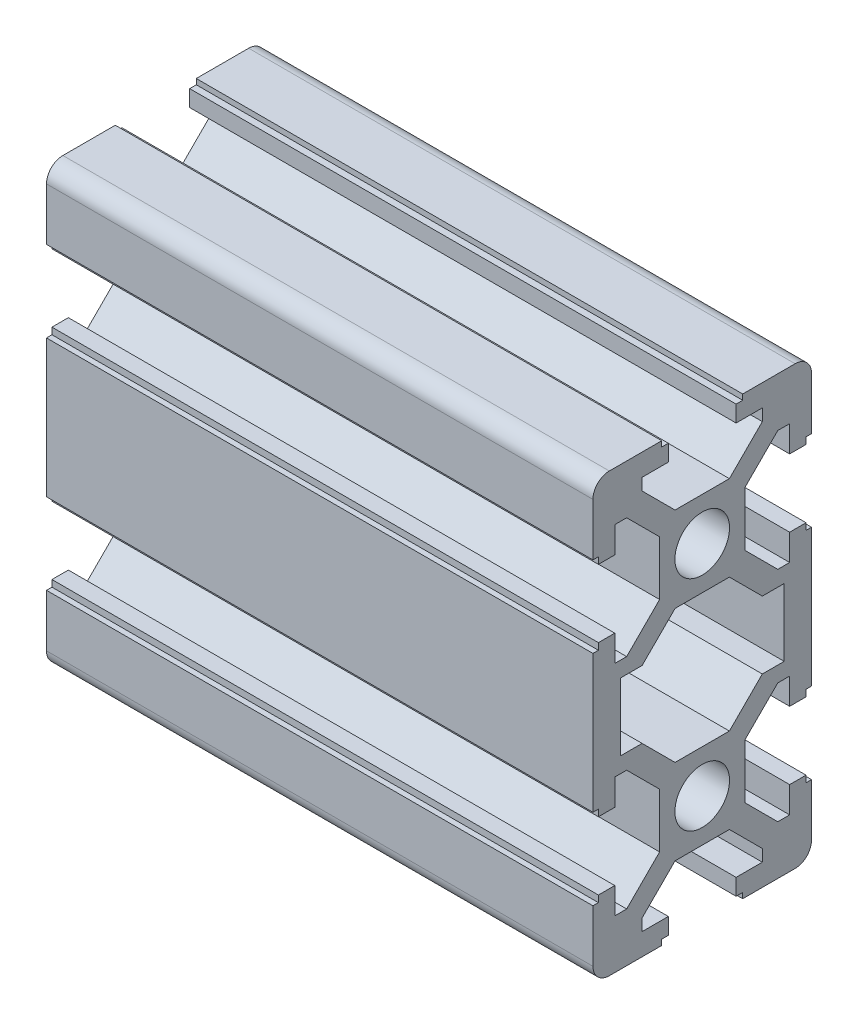
from build123d import *

# Parameters (mm, degrees)
SKETCH_1_W                = 1048
SKETCH_1_H                = 40
EXTRUDE_1_DEPTH           = 20
CUT_EXTRUDE_1_DEPTH       = 1049.239330799
CUT_EXTRUDE_2_REACH       = 1050.811
CUT_EXTRUDE_3_REACH       = 1050.239
CUT_EXTRUDE_3_END_RADIUS  = 5
SKETCH_4_W                = 0.605
SKETCH_4_H                = 0.5
CUT_EXTRUDE_4_DEPTH       = 1049.239330799
CUT_EXTRUDE_5_DEPTH       = 1049.737119623
CUT_EXTRUDE_6_REACH       = 1050.239
CUT_EXTRUDE_6_END_RADIUS  = 5
SKETCH_7_W                = 0.605
SKETCH_7_H                = 0.5
CUT_EXTRUDE_7_REACH       = 1050.811
CUT_EXTRUDE_8_REACH       = 1050.239
CUT_EXTRUDE_8_END_RADIUS  = 5
SKETCH_9_W                = 0.605
SKETCH_9_H                = 0.5
CUT_EXTRUDE_9_REACH       = 1050.239
CUT_EXTRUDE_9_END_RADIUS  = 5
SKETCH_10_W               = 0.605
SKETCH_10_H               = 0.5
CUT_EXTRUDE_10_DEPTH      = 1049.737119623
CUT_EXTRUDE_11_REACH      = 1050.239
CUT_EXTRUDE_11_END_RADIUS = 5
SKETCH_12_W               = 0.605
SKETCH_12_H               = 0.5
CUT_EXTRUDE_12_DEPTH      = 1049.239330799
CUT_EXTRUDE_13_DEPTH      = 1049.239330799
CUT_EXTRUDE_14_REACH      = 1050.239
CUT_EXTRUDE_14_END_RADIUS = 5
SKETCH_15_W               = 0.605
SKETCH_15_H               = 0.5
CUT_EXTRUDE_15_REACH      = 1050.239
CUT_EXTRUDE_15_END_RADIUS = 5
SKETCH_16_W               = 0.605
SKETCH_16_H               = 0.5
CUT_EXTRUDE_16_DEPTH      = 1049.239330799
CUT_EXTRUDE_17_DEPTH      = 1049.239330799
CUT_EXTRUDE_18_REACH      = 1050.239
CUT_EXTRUDE_18_END_RADIUS = 5
SKETCH_19_W               = 0.605
SKETCH_19_H               = 0.5
CUT_EXTRUDE_19_DEPTH      = 1049.239330799
DRAFT_1_ANGLE             = 45
DRAFT_2_ANGLE             = 45
SKETCH_21_W               = 5
SKETCH_21_H               = 5.49122085
SKETCH_22_W               = 5
SKETCH_22_H               = 5.49864809
HOLE_WIZARD_5_0_5_1_D     = 4.999999999
HOLE_WIZARD_5_0_5_2_D     = 4.999999999
FILLET_1_R                = 1.5
SKETCH_27_W               = 25
SKETCH_27_H               = 45
CUT_EXTRUDE_21_DEPTH      = 496.5
CUT_EXTRUDE_START         = -1048
SKETCH_28_W               = 25
SKETCH_28_H               = 45
CUT_EXTRUDE_22_DEPTH      = 501.5


with BuildPart() as part:
    # 草图1 → 凸台-拉伸1 (new body)
    with BuildSketch(Plane.XY.offset(9.92299271)):
        with Locations((-524, -0.00371362)):
            Rectangle(SKETCH_1_W, SKETCH_1_H)
    extrude(amount=-EXTRUDE_1_DEPTH)

    # 草图2 → 切除-拉伸1 (cut, through all)
    with BuildSketch(Plane(origin=(0, 0, 0), x_dir=(0, 0, -1), z_dir=(1, 0, 0))):
        Polygon((-3.02299271, 19.99628638), (-3.02299271, 17.99628638), (-5.42299271, 17.99628638), (-5.42299271, 16.91049994), (-2.40877915, 13.89628638), (2.56279373, 13.89628638), (5.57700729, 16.91049994), (5.57700729, 17.99628638), (3.17700729, 17.99628638), (3.17700729, 19.99628638), align=None)
    extrude(amount=-CUT_EXTRUDE_1_DEPTH, mode=Mode.SUBTRACT)

    # 草图3 → 切除-拉伸2 (cut, up to next)
    with BuildSketch(Plane(origin=(0, 19.99628638, 0), x_dir=(-1, 0, 0), z_dir=(0, 1, 0)), mode=Mode.PRIVATE) as cut_extrude_2_sk1:
        with BuildLine():
            Line((9.017348236, 3.02299271), (16.982651764, 3.02299271))
            ThreePointArc((16.982651764, 3.02299271), (13, 5), (9.017348236, 3.02299271))
        make_face()
    cut_extrude_2_tool1 = extrude(cut_extrude_2_sk1.sketch, amount=-CUT_EXTRUDE_2_REACH, mode=Mode.PRIVATE) & part.part
    add(cut_extrude_2_tool1.solids().sort_by_distance((-13, 19.996286, 3.828944))[0], mode=Mode.SUBTRACT)

    # 切除-拉伸3: up to this cylinder (the profile starts outside it)
    cut_extrude_3_end = Plane(origin=(-13, 19.746286, 0), z_dir=(0, 1, 0)) * Cylinder(CUT_EXTRUDE_3_END_RADIUS, 2111.478, mode=Mode.PRIVATE)
    # 草图4 → 切除-拉伸3 (cut, up to the surface)
    with BuildSketch(Plane.ZY.offset(1048), mode=Mode.PRIVATE) as cut_extrude_3_sk1:
        with Locations((3.32549271, 19.74628638)):
            Rectangle(SKETCH_4_W, SKETCH_4_H)
    cut_extrude_3_tool1 = extrude(cut_extrude_3_sk1.sketch, amount=-CUT_EXTRUDE_3_REACH, mode=Mode.PRIVATE) - cut_extrude_3_end
    add(cut_extrude_3_tool1.solids().sort_by_distance((-1048, 19.746286, 3.325493))[0], mode=Mode.SUBTRACT)

    # 草图5 → 切除-拉伸4 (cut, through all)
    with BuildSketch(Plane(origin=(0, 0, 0), x_dir=(0, 0, -1), z_dir=(1, 0, 0))):
        Polygon((-3.02299271, -20.00371362), (3.17700729, -20.00371362), (3.17700729, -18.00371362), (5.57700729, -18.00371362), (5.57700729, -16.91792718), (2.56279373, -13.90371362), (-2.40877915, -13.90371362), (-5.42299271, -16.91792718), (-5.42299271, -18.00371362), (-3.02299271, -18.00371362), align=None)
    extrude(amount=-CUT_EXTRUDE_4_DEPTH, mode=Mode.SUBTRACT)

    # 草图6 → 切除-拉伸5 (cut, through all)
    with BuildSketch(Plane(origin=(0, -18.00371362, 0), x_dir=(-1, 0, 0), z_dir=(0, 1, 0))):
        with BuildLine():
            Line((9.017348236, 3.02299271), (16.982651764, 3.02299271))
            ThreePointArc((16.982651764, 3.02299271), (13, 5), (9.017348236, 3.02299271))
        make_face()
    extrude(amount=-CUT_EXTRUDE_5_DEPTH, mode=Mode.SUBTRACT)

    # 切除-拉伸6: up to this cylinder (the profile starts outside it)
    cut_extrude_6_end = Plane(origin=(-13, -19.753714, 0), z_dir=(0, 1, 0)) * Cylinder(CUT_EXTRUDE_6_END_RADIUS, 2111.478, mode=Mode.PRIVATE)
    # 草图7 → 切除-拉伸6 (cut, up to the surface)
    with BuildSketch(Plane.ZY.offset(1048), mode=Mode.PRIVATE) as cut_extrude_6_sk1:
        with Locations((3.32549271, -19.75371362)):
            Rectangle(SKETCH_7_W, SKETCH_7_H)
    cut_extrude_6_tool1 = extrude(cut_extrude_6_sk1.sketch, amount=-CUT_EXTRUDE_6_REACH, mode=Mode.PRIVATE) - cut_extrude_6_end
    add(cut_extrude_6_tool1.solids().sort_by_distance((-1048, -19.753714, 3.325493))[0], mode=Mode.SUBTRACT)

    # 草图8 → 切除-拉伸7 (cut, up to next)
    with BuildSketch(Plane.XZ.offset(20.00371362), mode=Mode.PRIVATE) as cut_extrude_7_sk1:
        with BuildLine():
            Line((-9.139090175, -3.17700729), (-16.860909825, -3.17700729))
            ThreePointArc((-16.860909825, -3.17700729), (-13, -5), (-9.139090175, -3.17700729))
        make_face()
    cut_extrude_7_tool1 = extrude(cut_extrude_7_sk1.sketch, amount=-CUT_EXTRUDE_7_REACH, mode=Mode.PRIVATE) & part.part
    add(cut_extrude_7_tool1.solids().sort_by_distance((-13, -20.003714, -3.918953))[0], mode=Mode.SUBTRACT)

    # 切除-拉伸8: up to this cylinder (the profile starts outside it)
    cut_extrude_8_end = Plane(origin=(-13, -19.753714, 0), z_dir=(0, -1, 0)) * Cylinder(CUT_EXTRUDE_8_END_RADIUS, 2111.478, mode=Mode.PRIVATE)
    # 草图9 → 切除-拉伸8 (cut, up to the surface)
    with BuildSketch(Plane.ZY.offset(1048), mode=Mode.PRIVATE) as cut_extrude_8_sk1:
        with Locations((-3.47950729, -19.75371362)):
            Rectangle(SKETCH_9_W, SKETCH_9_H)
    cut_extrude_8_tool1 = extrude(cut_extrude_8_sk1.sketch, amount=-CUT_EXTRUDE_8_REACH, mode=Mode.PRIVATE) - cut_extrude_8_end
    add(cut_extrude_8_tool1.solids().sort_by_distance((-1048, -19.753714, -3.479507))[0], mode=Mode.SUBTRACT)

    # 切除-拉伸9: up to this cylinder (the profile starts outside it)
    cut_extrude_9_end = Plane(origin=(-13, 19.746286, 0), z_dir=(0, 1, 0)) * Cylinder(CUT_EXTRUDE_9_END_RADIUS, 2111.478, mode=Mode.PRIVATE)
    # 草图10 → 切除-拉伸9 (cut, up to the surface)
    with BuildSketch(Plane(origin=(0, 0, 0), x_dir=(0, 0, -1), z_dir=(1, 0, 0)), mode=Mode.PRIVATE) as cut_extrude_9_sk1:
        with Locations((-3.32549271, 19.74628638)):
            Rectangle(SKETCH_10_W, SKETCH_10_H)
    cut_extrude_9_tool1 = extrude(cut_extrude_9_sk1.sketch, amount=-CUT_EXTRUDE_9_REACH, mode=Mode.PRIVATE) - cut_extrude_9_end
    add(cut_extrude_9_tool1.solids().sort_by_distance((0, 19.746286, 3.325493))[0], mode=Mode.SUBTRACT)

    # 草图11 → 切除-拉伸10 (cut, through all)
    with BuildSketch(Plane.XZ.offset(-17.99628638)):
        with BuildLine():
            Line((-9.139090175, -3.17700729), (-16.860909825, -3.17700729))
            ThreePointArc((-16.860909825, -3.17700729), (-13, -5), (-9.139090175, -3.17700729))
        make_face()
    extrude(amount=-CUT_EXTRUDE_10_DEPTH, mode=Mode.SUBTRACT)

    # 切除-拉伸11: up to this cylinder (the profile starts outside it)
    cut_extrude_11_end = Plane(origin=(-13, 19.746286, 0), z_dir=(0, -1, 0)) * Cylinder(CUT_EXTRUDE_11_END_RADIUS, 2111.478, mode=Mode.PRIVATE)
    # 草图12 → 切除-拉伸11 (cut, up to the surface)
    with BuildSketch(Plane(origin=(0, 0, 0), x_dir=(0, 0, -1), z_dir=(1, 0, 0)), mode=Mode.PRIVATE) as cut_extrude_11_sk1:
        with Locations((3.47950729, 19.74628638)):
            Rectangle(SKETCH_12_W, SKETCH_12_H)
    cut_extrude_11_tool1 = extrude(cut_extrude_11_sk1.sketch, amount=-CUT_EXTRUDE_11_REACH, mode=Mode.PRIVATE) - cut_extrude_11_end
    add(cut_extrude_11_tool1.solids().sort_by_distance((0, 19.746286, -3.479507))[0], mode=Mode.SUBTRACT)

    # 草图13 → 切除-拉伸12 (cut, through all)
    with BuildSketch(Plane(origin=(0, 0, 0), x_dir=(0, 0, -1), z_dir=(1, 0, 0))):
        Polygon((10.07700729, 13.70128638), (9.57700729, 13.70128638), (9.57700729, 13.09628638), (8.07700729, 13.09628638), (8.07700729, 15.49628638), (6.99122085, 15.49628638), (3.97700729, 12.48207282), (3.97700729, 7.51049994), (6.99122085, 4.49628638), (8.07700729, 4.49628638), (8.07700729, 6.89628638), (9.57700729, 6.89628638), (9.57700729, 6.29128638), (10.07700729, 6.29128638), align=None)
    extrude(amount=-CUT_EXTRUDE_12_DEPTH, mode=Mode.SUBTRACT)

    # 草图14 → 切除-拉伸13 (cut, through all)
    with BuildSketch(Plane(origin=(0, 0, 0), x_dir=(0, 0, -1), z_dir=(1, 0, 0))):
        Polygon((10.07700729, -6.29871362), (9.57700729, -6.29871362), (9.57700729, -6.90371362), (8.07700729, -6.90371362), (8.07700729, -4.50371362), (6.99122085, -4.50371362), (3.97700729, -7.51792718), (3.97700729, -12.48950006), (6.99122085, -15.50371362), (8.07700729, -15.50371362), (8.07700729, -13.10371362), (9.57700729, -13.10371362), (9.57700729, -13.70871362), (10.07700729, -13.70871362), align=None)
    extrude(amount=-CUT_EXTRUDE_13_DEPTH, mode=Mode.SUBTRACT)

    # 切除-拉伸14: up to this cylinder (the profile starts outside it)
    cut_extrude_14_end = Plane(origin=(-13, -19.753714, 0), z_dir=(0, -1, 0)) * Cylinder(CUT_EXTRUDE_14_END_RADIUS, 2111.478, mode=Mode.PRIVATE)
    # 草图15 → 切除-拉伸14 (cut, up to the surface)
    with BuildSketch(Plane(origin=(0, 0, 0), x_dir=(0, 0, -1), z_dir=(1, 0, 0)), mode=Mode.PRIVATE) as cut_extrude_14_sk1:
        with Locations((3.47950729, -19.75371362)):
            Rectangle(SKETCH_15_W, SKETCH_15_H)
    cut_extrude_14_tool1 = extrude(cut_extrude_14_sk1.sketch, amount=-CUT_EXTRUDE_14_REACH, mode=Mode.PRIVATE) - cut_extrude_14_end
    add(cut_extrude_14_tool1.solids().sort_by_distance((0, -19.753714, -3.479507))[0], mode=Mode.SUBTRACT)

    # 切除-拉伸15: up to this cylinder (the profile starts outside it)
    cut_extrude_15_end = Plane(origin=(-13, -19.753714, 0), z_dir=(0, 1, 0)) * Cylinder(CUT_EXTRUDE_15_END_RADIUS, 2111.478, mode=Mode.PRIVATE)
    # 草图16 → 切除-拉伸15 (cut, up to the surface)
    with BuildSketch(Plane(origin=(0, 0, 0), x_dir=(0, 0, -1), z_dir=(1, 0, 0)), mode=Mode.PRIVATE) as cut_extrude_15_sk1:
        with Locations((-3.32549271, -19.75371362)):
            Rectangle(SKETCH_16_W, SKETCH_16_H)
    cut_extrude_15_tool1 = extrude(cut_extrude_15_sk1.sketch, amount=-CUT_EXTRUDE_15_REACH, mode=Mode.PRIVATE) - cut_extrude_15_end
    add(cut_extrude_15_tool1.solids().sort_by_distance((0, -19.753714, 3.325493))[0], mode=Mode.SUBTRACT)

    # 草图17 → 切除-拉伸16 (cut, through all)
    with BuildSketch(Plane(origin=(0, 0, 0), x_dir=(0, 0, -1), z_dir=(1, 0, 0))):
        Polygon((-9.92299271, -13.70871362), (-9.42299271, -13.70871362), (-9.42299271, -13.10371362), (-7.92299271, -13.10371362), (-7.92299271, -15.50371362), (-6.83720627, -15.50371362), (-3.82299271, -12.48950006), (-3.82299271, -7.51792718), (-6.83720627, -4.50371362), (-7.92299271, -4.50371362), (-7.92299271, -6.90371362), (-9.42299271, -6.90371362), (-9.42299271, -6.29871362), (-9.92299271, -6.29871362), align=None)
    extrude(amount=-CUT_EXTRUDE_16_DEPTH, mode=Mode.SUBTRACT)

    # 草图18 → 切除-拉伸17 (cut, through all)
    with BuildSketch(Plane(origin=(0, 0, 0), x_dir=(0, 0, -1), z_dir=(1, 0, 0))):
        Polygon((-9.92299271, 6.29128638), (-9.42299271, 6.29128638), (-9.42299271, 6.89628638), (-7.92299271, 6.89628638), (-7.92299271, 4.49628638), (-6.83720627, 4.49628638), (-3.82299271, 7.51049994), (-3.82299271, 12.48207282), (-6.83720627, 15.49628638), (-7.92299271, 15.49628638), (-7.92299271, 13.09628638), (-9.42299271, 13.09628638), (-9.42299271, 13.70128638), (-9.92299271, 13.70128638), align=None)
    extrude(amount=-CUT_EXTRUDE_17_DEPTH, mode=Mode.SUBTRACT)

    # 切除-拉伸18: up to this cylinder (the profile starts outside it)
    cut_extrude_18_end = Plane(origin=(-13, 19.746286, 0), z_dir=(0, -1, 0)) * Cylinder(CUT_EXTRUDE_18_END_RADIUS, 2111.478, mode=Mode.PRIVATE)
    # 草图19 → 切除-拉伸18 (cut, up to the surface)
    with BuildSketch(Plane.ZY.offset(1048), mode=Mode.PRIVATE) as cut_extrude_18_sk1:
        with Locations((-3.47950729, 19.74628638)):
            Rectangle(SKETCH_19_W, SKETCH_19_H)
    cut_extrude_18_tool1 = extrude(cut_extrude_18_sk1.sketch, amount=-CUT_EXTRUDE_18_REACH, mode=Mode.PRIVATE) - cut_extrude_18_end
    add(cut_extrude_18_tool1.solids().sort_by_distance((-1048, 19.746286, -3.479507))[0], mode=Mode.SUBTRACT)

    # 草图20 → 切除-拉伸19 (cut, through all)
    with BuildSketch(Plane.ZY.offset(1048)):
        Polygon((2.40877915, -3.08950006), (7.42299271, -3.08950006), (7.42299271, 3.08207282), (2.40877915, 3.08207282), (2.40877915, 6.09628638), (-2.56279373, 6.09628638), (-2.56279373, 3.08207282), (-7.57700729, 3.08207282), (-7.57700729, -3.08950006), (-2.56279373, -3.08950006), (-2.56279373, -6.10371362), (2.40877915, -6.10371362), align=None)
    extrude(amount=-CUT_EXTRUDE_19_DEPTH, mode=Mode.SUBTRACT)

    # 拔模1
    draft_1_faces = [part.faces().sort_by_distance(p)[0] for p in [
        (-524, -4.59660684, 2.40877915),
        (-524, -4.59660684, -2.56279373),
    ]]
    draft(draft_1_faces, Plane(origin=(0, -6.10371362, -2.56279373), x_dir=(0, 0, 1), z_dir=(0, 1, 0)), DRAFT_1_ANGLE)

    # 拔模2
    draft_2_faces = [part.faces().sort_by_distance(p)[0] for p in [
        (-524, 4.5891796, -2.56279373),
        (-524, 4.5891796, 2.40877915),
    ]]
    draft(draft_2_faces, Plane(origin=(0, 6.09628638, 2.40877915), x_dir=(0, 0, -1), z_dir=(0, -1, 0)), DRAFT_2_ANGLE)

    # 草图21 → 切除-旋转1 (revolve, cut)
    with BuildSketch(Plane(origin=(0, 0, 0), x_dir=(-1, 0, 0), z_dir=(0, 0, -1)), mode=Mode.PRIVATE) as cut_revolve_1_sk:
        with Locations((10.5, 13.741896805)):
            Rectangle(SKETCH_21_W, SKETCH_21_H)
    revolve(cut_revolve_1_sk.sketch.rotate(Axis((-13, 10.99628638, 0), (0, 1, 0)), 229.871289748), axis=Axis((-13, 10.99628638, 0), (0, 1, 0)), mode=Mode.SUBTRACT)

    # 草图22 → 切除-旋转2 (revolve, cut)
    with BuildSketch(Plane.XY, mode=Mode.PRIVATE) as cut_revolve_2_sk:
        with Locations((-10.5, -13.745610425)):
            Rectangle(SKETCH_22_W, SKETCH_22_H)
    revolve(cut_revolve_2_sk.sketch.rotate(Axis((-13, -10.99628638, 0), (0, -1, 0)), 232.693190821), axis=Axis((-13, -10.99628638, 0), (0, -1, 0)), mode=Mode.SUBTRACT)

    # Ø5.0 (5) 直径孔1 (through all)
    with Locations(Plane(origin=(0, 0, 0), x_dir=(0, 0, -1), z_dir=(1, 0, 0))):
        with Locations((0.07700729, 9.99628638)):
            Hole(HOLE_WIZARD_5_0_5_1_D / 2)

    # Ø5.0 (5) 直径孔2 (through all)
    with Locations(Plane.ZY.offset(1048)):
        with Locations((-0.07700729, -10.00371362)):
            Hole(HOLE_WIZARD_5_0_5_2_D / 2)

    # 圆角1
    fillet_1_edges = [part.edges().sort_by_distance(p)[0] for p in [
        (-524, -20.00371362, -10.07700729),
        (-524, 19.99628638, -10.07700729),
        (-524, -20.00371362, 9.92299271),
        (-524, 19.99628638, 9.92299271),
    ]]
    fillet(fillet_1_edges, radius=FILLET_1_R)

    # 草图27 → 切除-拉伸21 (cut)
    with BuildSketch(Plane(origin=(0, 0, 0), x_dir=(0, 0, -1), z_dir=(1, 0, 0))):
        Rectangle(SKETCH_27_W, SKETCH_27_H)
    extrude(amount=-CUT_EXTRUDE_21_DEPTH, mode=Mode.SUBTRACT)

    # 草图28 → 切除-拉伸22 (cut)
    with BuildSketch(Plane(origin=(0, 0, 0), x_dir=(0, 0, -1), z_dir=(1, 0, 0)).offset(CUT_EXTRUDE_START)):
        Rectangle(SKETCH_28_W, SKETCH_28_H)
    extrude(amount=CUT_EXTRUDE_22_DEPTH, mode=Mode.SUBTRACT)


solid = part.part
